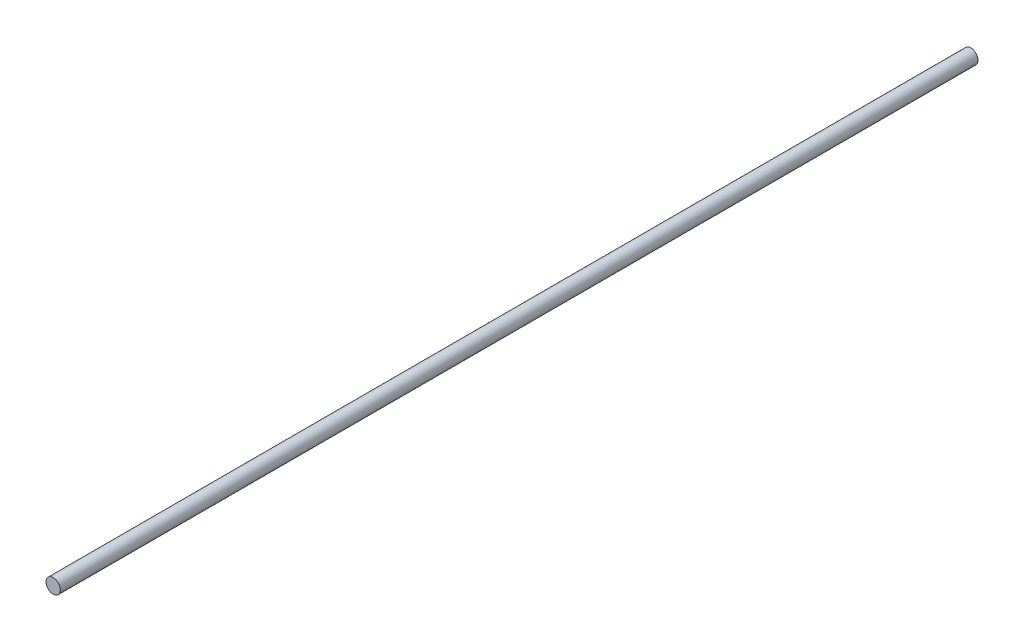
from build123d import *

# Parameters (mm, degrees)
SKETCH3_R           = 2.38125
BOSS_EXTRUDE1_DEPTH = 152.4


with BuildPart() as part:
    # Sketch3 → Boss-Extrude1 (new, symmetric)
    with BuildSketch(Plane.XY):
        with Locations(Location((0, 0, 0), (0, 0, 180))):
            Circle(SKETCH3_R)
    extrude(amount=BOSS_EXTRUDE1_DEPTH, both=True)


solid = part.part
